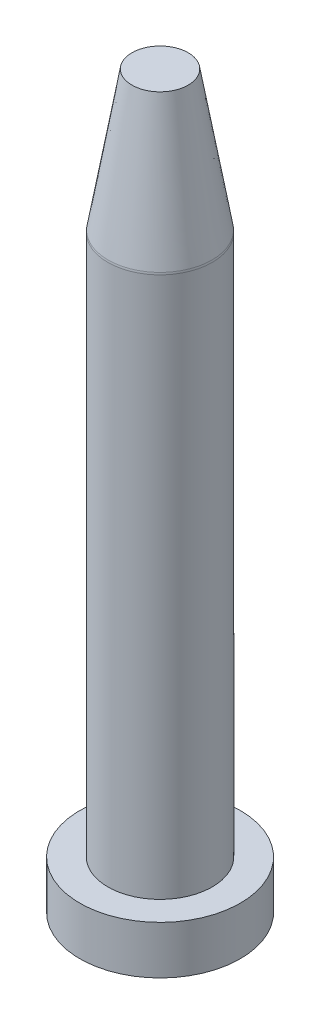
from build123d import *

# Parameters (mm, degrees)
FILLET_1_R = 3


with BuildPart() as part:
    # 草图1 → Revolve 297 (revolve)
    with BuildSketch(Plane.XY, mode=Mode.PRIVATE) as revolve_297_sk:
        Polygon((0, 0), (20, 0), (20, 12), (13, 12), (13, 147), (7, 182), (0, 182), align=None)
    revolve(revolve_297_sk.sketch.rotate(Axis((0, 0, 0), (0, 1, 0)), 90), axis=Axis((0, 0, 0), (0, 1, 0)))

    # 圆角1
    fillet_1_edges = [part.edges().sort_by_distance(p)[0] for p in [
        (0, 147, 13),
    ]]
    fillet(fillet_1_edges, radius=FILLET_1_R)


solid = part.part
